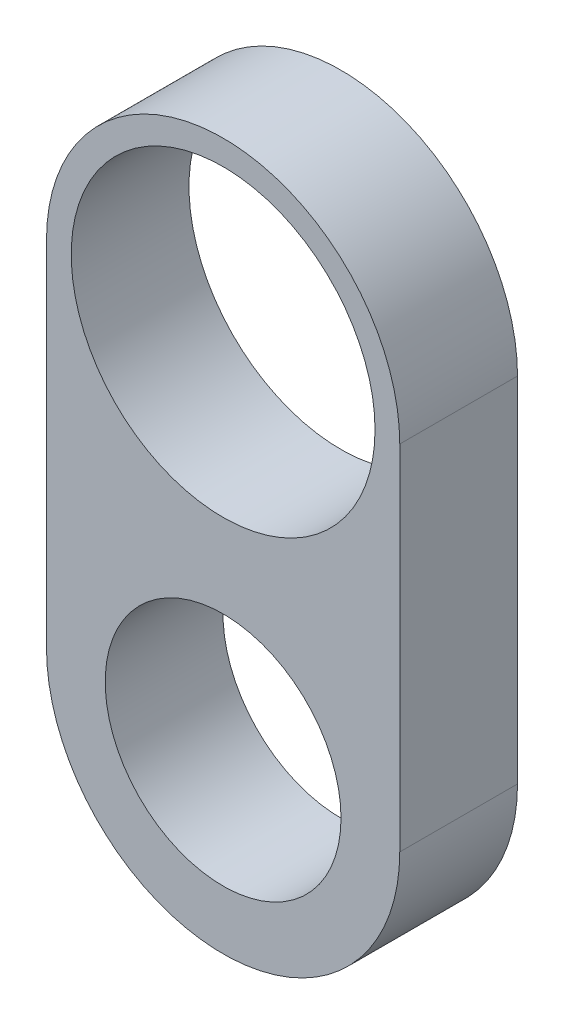
from build123d import *

# Parameters (mm, degrees)
BOSS_EXTRUDE1_DEPTH     = 12.7
CUT_EXTRUDE1_DEPTH      = 62.565534189
CUT_EXTRUDE1_DEPTH_BACK = 62.565534189
SKETCH2_R               = 12.71524
CUT_EXTRUDE2_DEPTH      = 62.565534189
CUT_EXTRUDE2_DEPTH_BACK = 62.565534189
SKETCH3_R               = 16.383


with BuildPart() as part:
    # Sketch1 → Boss-Extrude1 (new body)
    with BuildSketch(Plane.XY):
        with BuildLine():
            Line((-19.05, 0), (-19.05, 38.1))
            ThreePointArc((-19.05, 38.1), (0, 57.15), (19.05, 38.1))
            Line((19.05, 38.1), (19.05, 0))
            ThreePointArc((19.05, 0), (0, -19.05), (-19.05, 0))
        make_face()
    extrude(amount=BOSS_EXTRUDE1_DEPTH)

    # Sketch2 → Cut-Extrude1 (cut, two sides: drawn at the far end of the back side and taken through both)
    with BuildSketch(Plane.XY.offset(12.7).offset(-CUT_EXTRUDE1_DEPTH_BACK)):
        Circle(SKETCH2_R)
    extrude(amount=CUT_EXTRUDE1_DEPTH + CUT_EXTRUDE1_DEPTH_BACK, mode=Mode.SUBTRACT)

    # Sketch3 → Cut-Extrude2 (cut, two sides: drawn at the far end of the back side and taken through both)
    with BuildSketch(Plane.XY.offset(12.7).offset(-CUT_EXTRUDE2_DEPTH_BACK)):
        with Locations((0, 38.1)):
            Circle(SKETCH3_R)
    extrude(amount=CUT_EXTRUDE2_DEPTH + CUT_EXTRUDE2_DEPTH_BACK, mode=Mode.SUBTRACT)


solid = part.part
